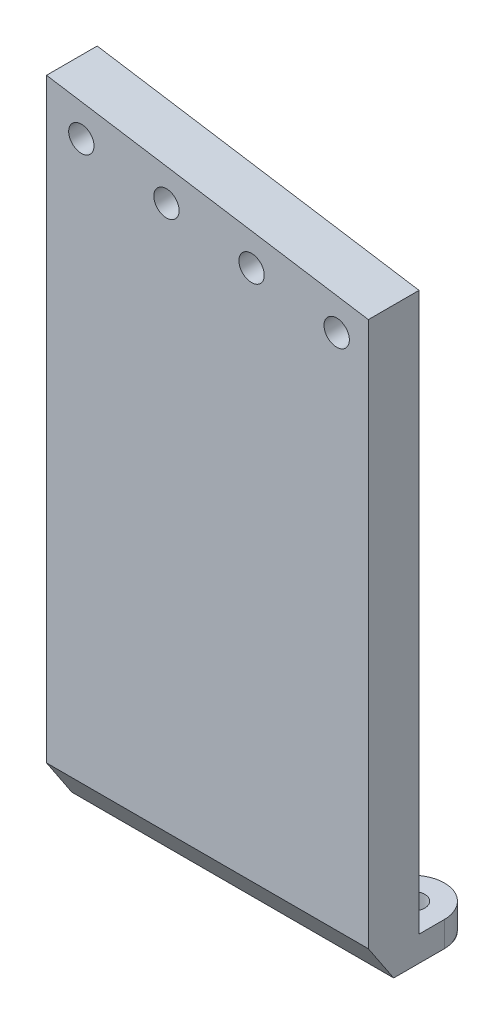
from build123d import *

# Parameters (mm, degrees)
SKETCH1_R               = 1.2065
BOSS_EXTRUDE1_DEPTH     = 2.54
SKETCH2_W               = 32.258
SKETCH2_H               = 5.08
BOSS_EXTRUDE2_DEPTH     = 60.96
CUT_EXTRUDE2_DEPTH      = 5.08
SKETCH3_R               = 1.27
CUT_EXTRUDE1_DEPTH      = 5.08
CUT_EXTRUDE3_DEPTH      = 32.258
SKETCH6_R               = 3.21939192
CUT_EXTRUDE4_DEPTH      = 2.54
SKETCH7_R               = 3.216046402
CUT_EXTRUDE5_DEPTH      = 2.54
CUT_EXTRUDE7_DEPTH      = 91.704054458
CUT_EXTRUDE7_DEPTH_BACK = 91.704054458
SKETCH8_W               = 34.637942207
SKETCH8_H               = 68.994690033


with BuildPart() as part:
    # Sketch1 → Boss-Extrude1 (new body)
    with BuildSketch(Plane(origin=(0, 0, 0), x_dir=(1, 0, 0), z_dir=(0, 1, 0))):
        with BuildLine():
            Line((0, 0), (32.258, 0))
            Line((32.258, 0), (32.258, 7.62))
            ThreePointArc((32.258, 7.62), (29.083, 10.795), (25.908, 7.62))
            Line((25.908, 7.62), (6.35, 7.62))
            ThreePointArc((6.35, 7.62), (3.175, 10.795), (0, 7.62))
            Line((0, 7.62), (0, 0))
        make_face()
        with Locations(Location((3.175, 7.62, 0), (0, 0, 270))):
            Circle(SKETCH1_R, mode=Mode.SUBTRACT)
        with Locations(Location((29.083, 7.62, 0), (0, 0, 270))):
            Circle(SKETCH1_R, mode=Mode.SUBTRACT)
    extrude(amount=BOSS_EXTRUDE1_DEPTH)

    # Sketch2 → Boss-Extrude2 (add)
    with BuildSketch(Plane(origin=(0, 2.54, 0), x_dir=(1, 0, 0), z_dir=(0, 1, 0))):
        with Locations((16.129, 2.54)):
            Rectangle(SKETCH2_W, SKETCH2_H)
    extrude(amount=BOSS_EXTRUDE2_DEPTH)

    # Sketch4 → Cut-Extrude2 (cut)
    with BuildSketch(Plane.XY):
        Polygon((32.258, 63.5), (0, 58.42), (0, 63.5), align=None)
    extrude(amount=-CUT_EXTRUDE2_DEPTH, mode=Mode.SUBTRACT)

    # Sketch3 → Cut-Extrude1 (cut)
    with BuildSketch(Plane(origin=(0, 0, -5.08), x_dir=(-1, 0, 0), z_dir=(0, 0, -1))):
        with Locations((-28.767594731, 59.736200914)):
            Circle(SKETCH3_R)
        with Locations((-20.236729821, 58.392757622)):
            Circle(SKETCH3_R)
        with Locations((-11.70586491, 57.049314329)):
            Circle(SKETCH3_R)
        with Locations((-3.175, 55.705871036)):
            Circle(SKETCH3_R)
    extrude(amount=-CUT_EXTRUDE1_DEPTH, mode=Mode.SUBTRACT)

    # Sketch5 → Cut-Extrude3 (cut)
    with BuildSketch(Plane.ZY):
        Polygon((0, 0), (-2.54, 0), (0, 3.81), align=None)
    extrude(amount=-CUT_EXTRUDE3_DEPTH, mode=Mode.SUBTRACT)

    # Sketch6 → Cut-Extrude4 (cut)
    with BuildSketch(Plane(origin=(0.626970779, -3.981264444, 0), x_dir=(0.9878259507117183, 0.1555631418443651, 0), z_dir=(-0.15556314184436507, 0.9878259507117182, 0))):
        with Locations((28.811866038, 7.647867292)):
            Circle(SKETCH6_R)
    extrude(amount=-CUT_EXTRUDE4_DEPTH, mode=Mode.SUBTRACT)

    # Sketch7 → Cut-Extrude5 (cut)
    with BuildSketch(Plane(origin=(0, 0, 0), x_dir=(0.9878259507117183, 0.1555631418443651, 0), z_dir=(-0.15556314184436507, 0.9878259507117182, 0))):
        with Locations((3.216043813, 7.615918666)):
            Circle(SKETCH7_R)
    extrude(amount=-CUT_EXTRUDE5_DEPTH, mode=Mode.SUBTRACT)

    # Mirror1: part across plane


with BuildPart() as part_1:
    add(part.part)
    add(part.part.mirror(Plane(origin=(32.258, 2.54, 0), x_dir=(0, 0, 1), z_dir=(-1, 0, 0))))

    # Sketch8 → Cut-Extrude7 (cut, two sides: drawn at the far end of the back side and taken through both)
    with BuildSketch(Plane(origin=(0, 0, -5.08), x_dir=(-1, 0, 0), z_dir=(0, 0, -1)).offset(-CUT_EXTRUDE7_DEPTH_BACK)):
        with Locations((-14.939028897, 29.002654984)):
            Rectangle(SKETCH8_W, SKETCH8_H)
    extrude(amount=CUT_EXTRUDE7_DEPTH + CUT_EXTRUDE7_DEPTH_BACK, mode=Mode.SUBTRACT)


solid = part_1.part
